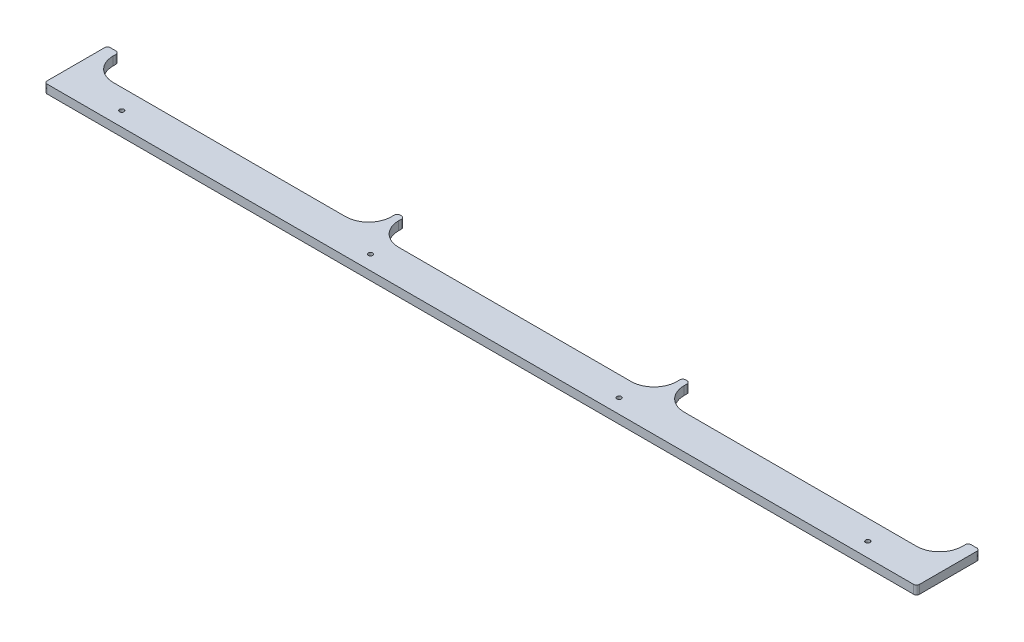
from build123d import *

# Parameters (mm, degrees)
SKETCH1_R           = 2.45745
BOSS_EXTRUDE1_DEPTH = 9.525
FILLET1_R           = 3.175


with BuildPart() as part:
    # Sketch1 → Boss-Extrude1 (new body)
    with BuildSketch(Plane(origin=(0, 0, 0), x_dir=(1, 0, 0), z_dir=(0, 1, 0))):
        with BuildLine():
            Line((0, 0), (965.2, 0))
            Line((965.2, 0), (965.2, 69.85))
            Line((965.2, 69.85), (952.5, 69.85))
            Line((952.5, 69.85), (952.5, 63.5))
            ThreePointArc((952.5, 63.5), (945.060512242, 45.539487758), (927.1, 38.1))
            Line((927.1, 38.1), (669.925, 38.1))
            ThreePointArc((669.925, 38.1), (651.964487758, 45.539487758), (644.525, 63.5))
            Line((644.525, 63.5), (644.525, 69.85))
            Line((644.525, 69.85), (636.5875, 69.85))
            Line((636.5875, 69.85), (636.5875, 63.5))
            ThreePointArc((636.5875, 63.5), (629.148012242, 45.539487758), (611.1875, 38.1))
            Line((611.1875, 38.1), (354.0125, 38.1))
            ThreePointArc((354.0125, 38.1), (336.051987758, 45.539487758), (328.6125, 63.5))
            Line((328.6125, 63.5), (328.6125, 69.85))
            Line((328.6125, 69.85), (320.675, 69.85))
            Line((320.675, 69.85), (320.675, 63.5))
            ThreePointArc((320.675, 63.5), (313.235512242, 45.539487758), (295.275, 38.1))
            Line((295.275, 38.1), (38.1, 38.1))
            ThreePointArc((38.1, 38.1), (20.139487758, 45.539487758), (12.7, 63.5))
            Line((12.7, 63.5), (12.7, 69.85))
            Line((12.7, 69.85), (0, 69.85))
            Line((0, 69.85), (0, 0))
        make_face()
        with Locations(Location((69.85, 15.875, 0), (0, 0, 90))):
            Circle(SKETCH1_R, mode=Mode.SUBTRACT)
        with Locations(Location((345.01582, 15.875, 0), (0, 0, 90))):
            Circle(SKETCH1_R, mode=Mode.SUBTRACT)
        with Locations(Location((895.35, 15.875, 0), (0, 0, 90))):
            Circle(SKETCH1_R, mode=Mode.SUBTRACT)
        with Locations(Location((620.18418, 15.875, 0), (0, 0, 90))):
            Circle(SKETCH1_R, mode=Mode.SUBTRACT)
    extrude(amount=BOSS_EXTRUDE1_DEPTH)

    # Fillet1
    fillet1_edges = [part.edges().sort_by_distance(p)[0] for p in [
        (0, 4.7625, -69.85),
        (12.7, 4.7625, -69.85),
        (320.675, 4.7625, -69.85),
        (328.6125, 4.7625, -69.85),
        (636.5875, 4.7625, -69.85),
        (644.525, 4.7625, -69.85),
        (952.5, 4.7625, -69.85),
        (965.2, 4.7625, -69.85),
        (965.2, 4.7625, 0),
        (0, 4.7625, 0),
    ]]
    fillet(fillet1_edges, radius=FILLET1_R)


solid = part.part
